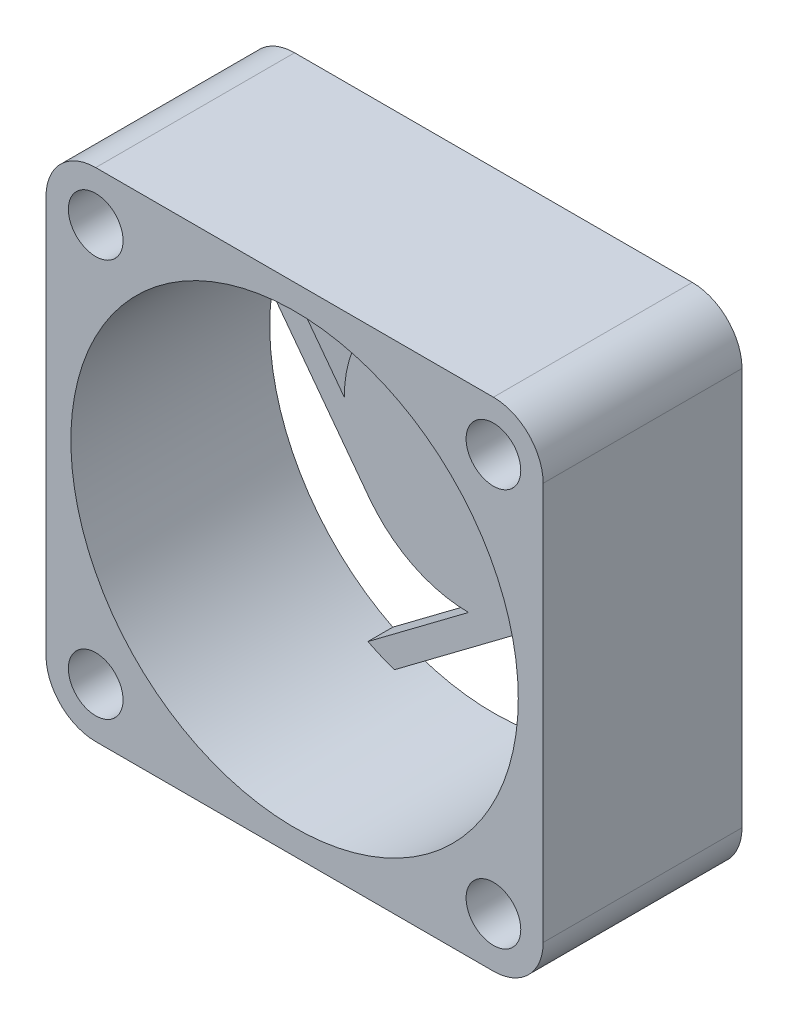
from build123d import *
from build123d.topology import SkipClean

# Parameters (mm, degrees)
SKETCH1_W           = 20
SKETCH1_H           = 20
SKETCH1_R           = 1.1
BOSS_EXTRUDE1_DEPTH = 8
SKETCH2_R           = 9
CUT_EXTRUDE1_DEPTH  = 7
CUT_EXTRUDE2_REACH  = 17.78
FILLET1_R           = 2


with BuildPart() as part:
    # Sketch1 → Boss-Extrude1 (new body)
    with BuildSketch(Plane.XY):
        Rectangle(SKETCH1_W, SKETCH1_H)
        with Locations((-8, 8)):
            Circle(SKETCH1_R, mode=Mode.SUBTRACT)
        with Locations((-8, -8)):
            Circle(SKETCH1_R, mode=Mode.SUBTRACT)
        with Locations((8, -8)):
            Circle(SKETCH1_R, mode=Mode.SUBTRACT)
        with Locations((8, 8)):
            Circle(SKETCH1_R, mode=Mode.SUBTRACT)
    extrude(amount=BOSS_EXTRUDE1_DEPTH)

    # Sketch2 → Cut-Extrude1 (cut)
    with BuildSketch(Plane.XY.offset(8)):
        Circle(SKETCH2_R)
    extrude(amount=-CUT_EXTRUDE1_DEPTH, mode=Mode.SUBTRACT)

    # Sketch3 → Cut-Extrude2 (cut, up to next)
    with BuildSketch(Plane.XY.offset(1), mode=Mode.PRIVATE) as cut_extrude2_sk1:
        with BuildLine():
            Line((3, -4), (-2.986651819, -8.489988864))
            ThreePointArc((-2.986651819, -8.489988864), (3.362470118, -8.348280943), (8.037354649, -4.049806199))
            Line((8.037354649, -4.049806199), (5, 0))
            ThreePointArc((5, 0), (4.472135955, -2.236067977), (3, -4))
        make_face()
    cut_extrude2_tool1 = extrude(cut_extrude2_sk1.sketch, amount=-CUT_EXTRUDE2_REACH, mode=Mode.PRIVATE) & part.part
    # Sketch3 → Cut-Extrude2 (cut, up to next)
    with BuildSketch(Plane.XY.offset(1), mode=Mode.PRIVATE) as cut_extrude2_sk2:
        with BuildLine():
            Line((0, -5), (-4.049806199, -8.037354649))
            ThreePointArc((-4.049806199, -8.037354649), (-8.348280943, -3.362470118), (-8.489988864, 2.986651819))
            Line((-8.489988864, 2.986651819), (-4, -3))
            ThreePointArc((-4, -3), (-2.236067977, -4.472135955), (0, -5))
        make_face()
    cut_extrude2_tool2 = extrude(cut_extrude2_sk2.sketch, amount=-CUT_EXTRUDE2_REACH, mode=Mode.PRIVATE) & part.part
    # Sketch3 → Cut-Extrude2 (cut, up to next)
    with BuildSketch(Plane.XY.offset(1), mode=Mode.PRIVATE) as cut_extrude2_sk3:
        with BuildLine():
            Line((-5, 0), (-8.037354649, 4.049806199))
            ThreePointArc((-8.037354649, 4.049806199), (-3.362470118, 8.348280943), (2.986651819, 8.489988864))
            Line((2.986651819, 8.489988864), (-3, 4))
            ThreePointArc((-3, 4), (-4.472135955, 2.236067977), (-5, 0))
        make_face()
    cut_extrude2_tool3 = extrude(cut_extrude2_sk3.sketch, amount=-CUT_EXTRUDE2_REACH, mode=Mode.PRIVATE) & part.part
    # Sketch3 → Cut-Extrude2 (cut, up to next)
    with BuildSketch(Plane.XY.offset(1), mode=Mode.PRIVATE) as cut_extrude2_sk4:
        with BuildLine():
            Line((0, 5), (4.049806199, 8.037354649))
            ThreePointArc((4.049806199, 8.037354649), (8.348280943, 3.362470118), (8.489988864, -2.986651819))
            Line((8.489988864, -2.986651819), (4, 3))
            ThreePointArc((4, 3), (2.236067977, 4.472135955), (0, 5))
        make_face()
    cut_extrude2_tool4 = extrude(cut_extrude2_sk4.sketch, amount=-CUT_EXTRUDE2_REACH, mode=Mode.PRIVATE) & part.part
    add(cut_extrude2_tool1.solids().sort_by_distance((3.411894, -5.668567, 1))[0], mode=Mode.SUBTRACT)
    add(cut_extrude2_tool2.solids().sort_by_distance((-5.668567, -3.411894, 1))[0], mode=Mode.SUBTRACT)
    add(cut_extrude2_tool3.solids().sort_by_distance((-3.411894, 5.668567, 1))[0], mode=Mode.SUBTRACT)
    add(cut_extrude2_tool4.solids().sort_by_distance((5.668567, 3.411894, 1))[0], mode=Mode.SUBTRACT)

    # Fillet1
    fillet1_edges = [part.edges().sort_by_distance(p)[0] for p in [
        (10, -10, 4),
        (-10, -10, 4),
        (-10, 10, 4),
        (10, 10, 4),
    ]]
    fillet(fillet1_edges, radius=FILLET1_R)


solid = part.part
